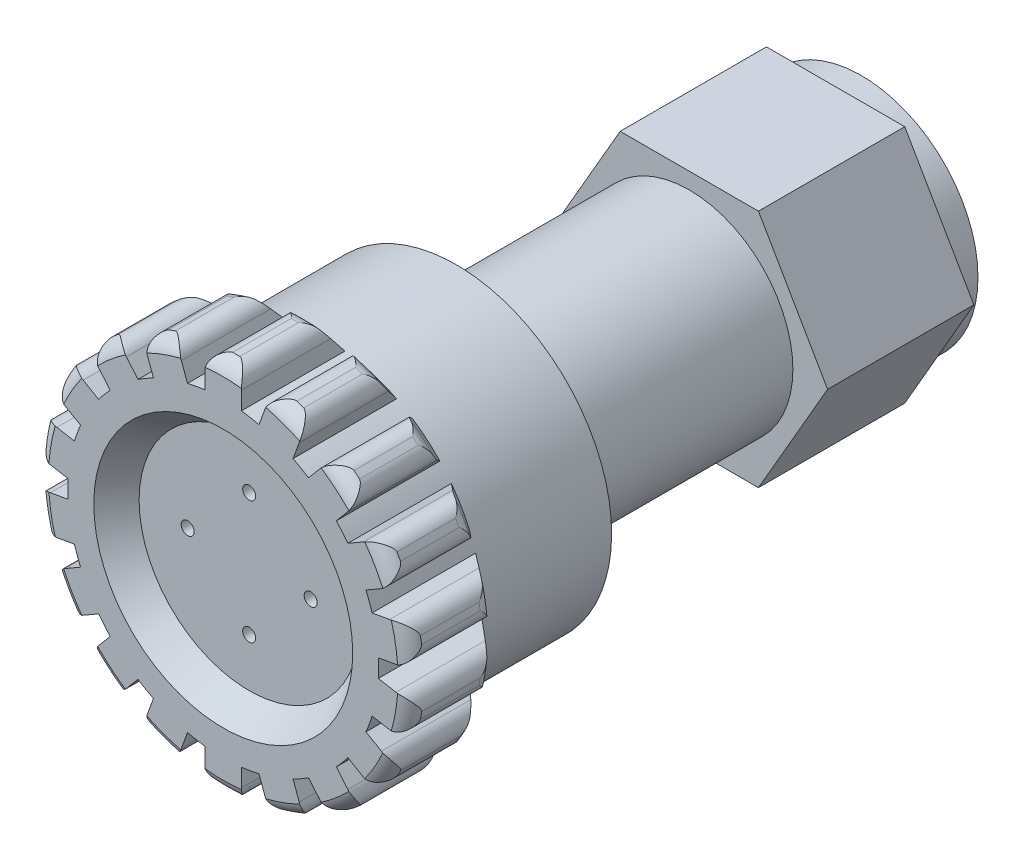
from build123d import *

# Parameters (mm, degrees)
SKETCH_1_R          = 9
SKETCH_1_R_2        = 6
EXTRUDE_1_DEPTH     = 2
SKETCH_2_R          = 6
EXTRUDE_2_DEPTH     = 11.3
SKETCH_3_R          = 8
SKETCH_3_R_2        = 6
EXTRUDE_3_DEPTH     = 18
SKETCH_4_R          = 12
EXTRUDE_4_DEPTH     = 18
EXTRUDE_5_DEPTH     = 8
SKETCH_9_R          = 0.5
CUT_EXTRUDE_1_DEPTH = 18


with BuildPart() as part:
    # 草图1 → 凸台-拉伸1 (new body)
    with BuildSketch(Plane.XY):
        Circle(SKETCH_1_R)
        Circle(SKETCH_1_R_2, mode=Mode.SUBTRACT)
    extrude(amount=EXTRUDE_1_DEPTH)

    # 草图2 → 凸台-拉伸2 (add)
    with BuildSketch(Plane.XY.offset(2)):
        Polygon((10.68097998, 0), (5.34048999, 9.25), (-5.34048999, 9.25), (-10.68097998, 0), (-5.34048999, -9.25), (5.34048999, -9.25), align=None)
        Circle(SKETCH_2_R, mode=Mode.SUBTRACT)
    extrude(amount=EXTRUDE_2_DEPTH)

    # 草图3 → 凸台-拉伸3 (add)
    with BuildSketch(Plane.XY.offset(13.3)):
        Circle(SKETCH_3_R)
        Circle(SKETCH_3_R_2, mode=Mode.SUBTRACT)
    extrude(amount=EXTRUDE_3_DEPTH)

    # 草图4 → 凸台-拉伸4 (add)
    with BuildSketch(Plane.XY.offset(31.3)):
        Circle(SKETCH_4_R)
    extrude(amount=EXTRUDE_4_DEPTH)

    # 草图6 → 凸台-拉伸5 (add)
    with BuildSketch(Plane.XY.offset(49.3)):
        with BuildLine():
            Line((2.760644708, 11.678135159), (3.233298237, 12.976740057))
            ThreePointArc((3.233298237, 12.976740057), (3.853787468, 13.65388523), (4.771353554, 13.69394703))
            Line((4.771353554, 13.69394703), (5.147230602, 13.557138973))
            ThreePointArc((5.147230602, 13.557138973), (5.824375775, 12.936649742), (5.864437575, 12.019083656))
            Line((5.864437575, 12.019083656), (5.391784046, 10.720478758))
            Line((5.391784046, 10.720478758), (2.760644708, 11.678135159))
        make_face()
        with BuildLine():
            Line((-1.4, 11.918053532), (1.4, 11.918053532))
            Line((1.4, 11.918053532), (1.4, 13.3))
            ThreePointArc((1.4, 13.3), (1.048528137, 14.148528137), (0.2, 14.5))
            Line((0.2, 14.5), (-0.2, 14.5))
            ThreePointArc((-0.2, 14.5), (-1.048528137, 14.148528137), (-1.4, 13.3))
            Line((-1.4, 13.3), (-1.4, 11.918053532))
        make_face()
        with BuildLine():
            Line((6.588314922, 10.029661335), (7.476612988, 11.088293747))
            ThreePointArc((7.476612988, 11.088293747), (8.291279429, 11.512382253), (9.167211452, 11.236201947))
            Line((9.167211452, 11.236201947), (9.473629229, 10.979086903))
            ThreePointArc((9.473629229, 10.979086903), (9.897717735, 10.164420463), (9.621537429, 9.28848844))
            Line((9.621537429, 9.28848844), (8.733239363, 8.229856028))
            Line((8.733239363, 8.229856028), (6.588314922, 10.029661335))
        make_face()
        with BuildLine():
            Line((9.621337123, 7.171462331), (10.81813787, 7.862435565))
            ThreePointArc((10.81813787, 7.862435565), (11.728720724, 7.982316072), (12.457368355, 7.423205081))
            Line((12.457368355, 7.423205081), (12.657368355, 7.076794919))
            ThreePointArc((12.657368355, 7.076794919), (12.777248862, 6.166212065), (12.21813787, 5.437564435))
            Line((12.21813787, 5.437564435), (11.021337123, 4.746591201))
            Line((11.021337123, 4.746591201), (9.621337123, 7.171462331))
        make_face()
        with BuildLine():
            Line((11.493884071, 3.448279131), (12.854835666, 3.688251617))
            ThreePointArc((12.854835666, 3.688251617), (13.751505203, 3.489464767), (14.244982783, 2.714860127))
            Line((14.244982783, 2.714860127), (14.314442054, 2.320937026))
            ThreePointArc((14.314442054, 2.320937026), (14.115655204, 1.424267489), (13.341050564, 0.930789909))
            Line((13.341050564, 0.930789909), (11.980098968, 0.690817423))
            Line((11.980098968, 0.690817423), (11.493884071, 3.448279131))
        make_face()
        with BuildLine():
            Line((11.980098968, -0.690817423), (13.341050564, -0.930789909))
            ThreePointArc((13.341050564, -0.930789909), (14.115655204, -1.424267489), (14.314442054, -2.320937026))
            Line((14.314442054, -2.320937026), (14.244982783, -2.714860127))
            ThreePointArc((14.244982783, -2.714860127), (13.751505203, -3.489464767), (12.854835666, -3.688251617))
            Line((12.854835666, -3.688251617), (11.493884071, -3.448279131))
            Line((11.493884071, -3.448279131), (11.980098968, -0.690817423))
        make_face()
        with BuildLine():
            Line((11.021337123, -4.746591201), (12.21813787, -5.437564435))
            ThreePointArc((12.21813787, -5.437564435), (12.777248862, -6.166212065), (12.657368355, -7.076794919))
            Line((12.657368355, -7.076794919), (12.457368355, -7.423205081))
            ThreePointArc((12.457368355, -7.423205081), (11.728720724, -7.982316072), (10.81813787, -7.862435565))
            Line((10.81813787, -7.862435565), (9.621337123, -7.171462331))
            Line((9.621337123, -7.171462331), (11.021337123, -4.746591201))
        make_face()
        with BuildLine():
            Line((8.733239363, -8.229856028), (9.621537429, -9.28848844))
            ThreePointArc((9.621537429, -9.28848844), (9.897717735, -10.164420463), (9.473629229, -10.979086903))
            Line((9.473629229, -10.979086903), (9.167211452, -11.236201947))
            ThreePointArc((9.167211452, -11.236201947), (8.291279429, -11.512382253), (7.476612988, -11.088293747))
            Line((7.476612988, -11.088293747), (6.588314922, -10.029661335))
            Line((6.588314922, -10.029661335), (8.733239363, -8.229856028))
        make_face()
        with BuildLine():
            Line((5.391784046, -10.720478758), (5.864437575, -12.019083656))
            ThreePointArc((5.864437575, -12.019083656), (5.824375775, -12.936649742), (5.147230602, -13.557138973))
            Line((5.147230602, -13.557138973), (4.771353554, -13.69394703))
            ThreePointArc((4.771353554, -13.69394703), (3.853787468, -13.65388523), (3.233298237, -12.976740057))
            Line((3.233298237, -12.976740057), (2.760644708, -11.678135159))
            Line((2.760644708, -11.678135159), (5.391784046, -10.720478758))
        make_face()
        with BuildLine():
            Line((1.4, -11.918053532), (1.4, -13.3))
            ThreePointArc((1.4, -13.3), (1.048528137, -14.148528137), (0.2, -14.5))
            Line((0.2, -14.5), (-0.2, -14.5))
            ThreePointArc((-0.2, -14.5), (-1.048528137, -14.148528137), (-1.4, -13.3))
            Line((-1.4, -13.3), (-1.4, -11.918053532))
            Line((-1.4, -11.918053532), (1.4, -11.918053532))
        make_face()
        with BuildLine():
            Line((-2.760644708, -11.678135159), (-3.233298237, -12.976740057))
            ThreePointArc((-3.233298237, -12.976740057), (-3.853787468, -13.65388523), (-4.771353554, -13.69394703))
            Line((-4.771353554, -13.69394703), (-5.147230602, -13.557138973))
            ThreePointArc((-5.147230602, -13.557138973), (-5.824375775, -12.936649742), (-5.864437575, -12.019083656))
            Line((-5.864437575, -12.019083656), (-5.391784046, -10.720478758))
            Line((-5.391784046, -10.720478758), (-2.760644708, -11.678135159))
        make_face()
        with BuildLine():
            Line((-6.588314922, -10.029661335), (-7.476612988, -11.088293747))
            ThreePointArc((-7.476612988, -11.088293747), (-8.291279429, -11.512382253), (-9.167211452, -11.236201947))
            Line((-9.167211452, -11.236201947), (-9.473629229, -10.979086903))
            ThreePointArc((-9.473629229, -10.979086903), (-9.897717735, -10.164420463), (-9.621537429, -9.28848844))
            Line((-9.621537429, -9.28848844), (-8.733239363, -8.229856028))
            Line((-8.733239363, -8.229856028), (-6.588314922, -10.029661335))
        make_face()
        with BuildLine():
            Line((-9.621337123, -7.171462331), (-10.81813787, -7.862435565))
            ThreePointArc((-10.81813787, -7.862435565), (-11.728720724, -7.982316072), (-12.457368355, -7.423205081))
            Line((-12.457368355, -7.423205081), (-12.657368355, -7.076794919))
            ThreePointArc((-12.657368355, -7.076794919), (-12.777248862, -6.166212065), (-12.21813787, -5.437564435))
            Line((-12.21813787, -5.437564435), (-11.021337123, -4.746591201))
            Line((-11.021337123, -4.746591201), (-9.621337123, -7.171462331))
        make_face()
        with BuildLine():
            Line((-11.493884071, -3.448279131), (-12.854835666, -3.688251617))
            ThreePointArc((-12.854835666, -3.688251617), (-13.751505203, -3.489464767), (-14.244982783, -2.714860127))
            Line((-14.244982783, -2.714860127), (-14.314442054, -2.320937026))
            ThreePointArc((-14.314442054, -2.320937026), (-14.115655204, -1.424267489), (-13.341050564, -0.930789909))
            Line((-13.341050564, -0.930789909), (-11.980098968, -0.690817423))
            Line((-11.980098968, -0.690817423), (-11.493884071, -3.448279131))
        make_face()
        with BuildLine():
            Line((-11.980098968, 0.690817423), (-13.341050564, 0.930789909))
            ThreePointArc((-13.341050564, 0.930789909), (-14.115655204, 1.424267489), (-14.314442054, 2.320937026))
            Line((-14.314442054, 2.320937026), (-14.244982783, 2.714860127))
            ThreePointArc((-14.244982783, 2.714860127), (-13.751505203, 3.489464767), (-12.854835666, 3.688251617))
            Line((-12.854835666, 3.688251617), (-11.493884071, 3.448279131))
            Line((-11.493884071, 3.448279131), (-11.980098968, 0.690817423))
        make_face()
        with BuildLine():
            Line((-11.021337123, 4.746591201), (-12.21813787, 5.437564435))
            ThreePointArc((-12.21813787, 5.437564435), (-12.777248862, 6.166212065), (-12.657368355, 7.076794919))
            Line((-12.657368355, 7.076794919), (-12.457368355, 7.423205081))
            ThreePointArc((-12.457368355, 7.423205081), (-11.728720724, 7.982316072), (-10.81813787, 7.862435565))
            Line((-10.81813787, 7.862435565), (-9.621337123, 7.171462331))
            Line((-9.621337123, 7.171462331), (-11.021337123, 4.746591201))
        make_face()
        with BuildLine():
            Line((-8.733239363, 8.229856028), (-9.621537429, 9.28848844))
            ThreePointArc((-9.621537429, 9.28848844), (-9.897717735, 10.164420463), (-9.473629229, 10.979086903))
            Line((-9.473629229, 10.979086903), (-9.167211452, 11.236201947))
            ThreePointArc((-9.167211452, 11.236201947), (-8.291279429, 11.512382253), (-7.476612988, 11.088293747))
            Line((-7.476612988, 11.088293747), (-6.588314922, 10.029661335))
            Line((-6.588314922, 10.029661335), (-8.733239363, 8.229856028))
        make_face()
        with BuildLine():
            Line((-5.391784046, 10.720478758), (-5.864437575, 12.019083656))
            ThreePointArc((-5.864437575, 12.019083656), (-5.824375775, 12.936649742), (-5.147230602, 13.557138973))
            Line((-5.147230602, 13.557138973), (-4.771353554, 13.69394703))
            ThreePointArc((-4.771353554, 13.69394703), (-3.853787468, 13.65388523), (-3.233298237, 12.976740057))
            Line((-3.233298237, 12.976740057), (-2.760644708, 11.678135159))
            Line((-2.760644708, 11.678135159), (-5.391784046, 10.720478758))
        make_face()
    extrude(amount=-EXTRUDE_5_DEPTH)

    # 草图8 → 切除-旋转4 (revolve, cut)
    with BuildSketch(Plane(origin=(0, 0, 0), x_dir=(0, 0, -1), z_dir=(1, 0, 0)), mode=Mode.PRIVATE) as cut_revolve_4_sk:
        with BuildLine():
            Line((-41.3, 12), (-41.3, 14.5))
            Line((-41.3, 14.5), (-41.3, 14.765184369))
            Line((-41.3, 14.765184369), (-49.3, 14.765184369))
            Line((-49.3, 14.765184369), (-49.3, 14.5))
            Line((-49.3, 14.5), (-49.3, 13.5))
            ThreePointArc((-49.3, 13.5), (-48.927153309, 14.127153309), (-48.3, 14.5))
            Line((-48.3, 14.5), (-43.780624847, 14.5))
            ThreePointArc((-43.780624847, 14.5), (-43.347436117, 14.401303236), (-42.999756038, 14.124695048))
            Line((-42.999756038, 14.124695048), (-41.3, 12))
        make_face()
        Polygon((-47.3, 0), (-47.3, 8.5), (-49.3, 10), (-49.3, 0), align=None)
    revolve(cut_revolve_4_sk.sketch.rotate(Axis((0, 0, 0), (0, 0, 1)), 86.699765178), axis=Axis((0, 0, 0), (0, 0, 1)), mode=Mode.SUBTRACT)

    # 草图9 → 切除-拉伸1 (cut)
    with BuildSketch(Plane.XY.offset(47.3)):
        with Locations((0, 4.75)):
            Circle(SKETCH_9_R)
        with Locations((4.75, 0)):
            Circle(SKETCH_9_R)
        with Locations((0, -4.75)):
            Circle(SKETCH_9_R)
        with Locations((-4.75, 0)):
            Circle(SKETCH_9_R)
    extrude(amount=-CUT_EXTRUDE_1_DEPTH, mode=Mode.SUBTRACT)


solid = part.part
